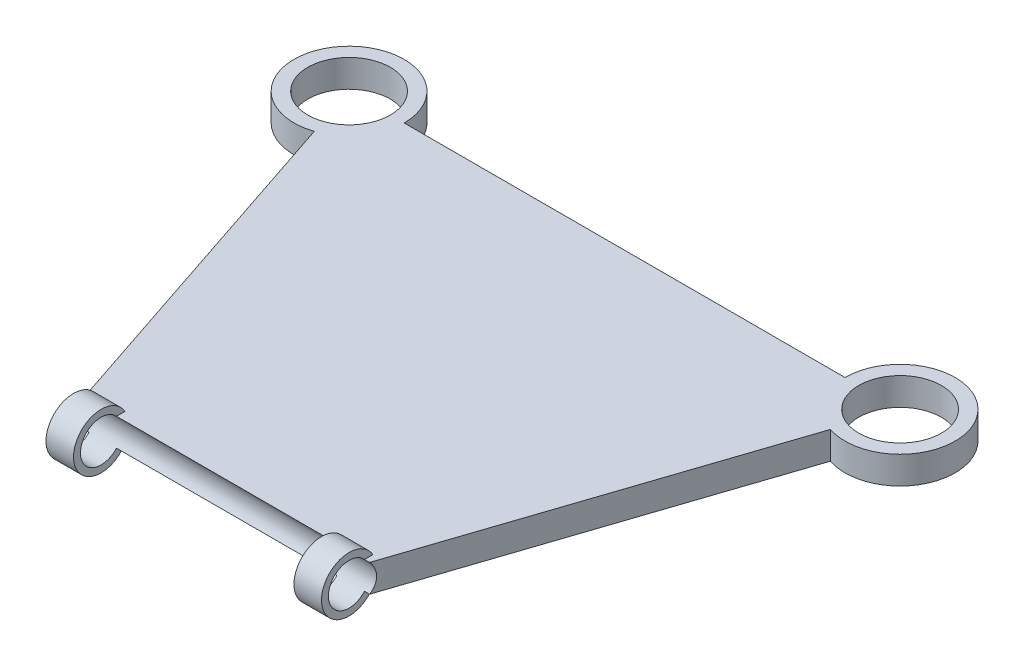
from build123d import *

# Parameters (mm, degrees)
SKETCH1_R               = 48
BOSS_EXTRUDE1_DEPTH     = 32
SKETCH2_R               = 32
SKETCH2_R_2             = 24
BOSS_EXTRUDE2_DEPTH     = 32
BOSS_EXTRUDE3_START     = 32
SKETCH3_R               = 32
SKETCH3_R_2             = 24
BOSS_EXTRUDE3_DEPTH     = 32
CUT_EXTRUDE1_DEPTH      = 32
CUT_EXTRUDE1_DEPTH_BACK = 689
SKETCH4_R               = 24


with BuildPart() as part:
    # Sketch1 → Boss-Extrude1 (new body)
    with BuildSketch(Plane(origin=(0, 0, 0), x_dir=(1, 0, 0), z_dir=(0, 1, 0))):
        with BuildLine():
            ThreePointArc((64, 0), (-51.919499851, 37.421458218), (20.238577025, -60.715731075))
            Line((20.238577025, -60.715731075), (160, -480))
            Line((160, -480), (480, -480))
            Line((480, -480), (619.761422975, -60.715731075))
            ThreePointArc((619.761422975, -60.715731075), (691.919499851, 37.421458218), (576, 0))
            Line((576, 0), (64, 0))
        make_face()
        with Locations(Location((0, 0, 0), (0, 0, 270))):
            Circle(SKETCH1_R, mode=Mode.SUBTRACT)
        with Locations(Location((640, 0, 0), (0, 0, 270))):
            Circle(SKETCH1_R, mode=Mode.SUBTRACT)
    extrude(amount=BOSS_EXTRUDE1_DEPTH)

    # Sketch2 → Boss-Extrude2 (add)
    with BuildSketch(Plane(origin=(160, 0, 0), x_dir=(0, -1, 0), z_dir=(-1, 0, 0))):
        with Locations((-16, 480)):
            Circle(SKETCH2_R)
        with Locations((-16, 480)):
            Circle(SKETCH2_R_2, mode=Mode.SUBTRACT)
    extrude(amount=-BOSS_EXTRUDE2_DEPTH)

    # Sketch3 → Boss-Extrude3 (add)
    with BuildSketch(Plane(origin=(480, 0, 0), x_dir=(0, -1, 0), z_dir=(-1, 0, 0)).offset(BOSS_EXTRUDE3_START)):
        with Locations((-16, 480)):
            Circle(SKETCH3_R)
        with Locations((-16, 480)):
            Circle(SKETCH3_R_2, mode=Mode.SUBTRACT)
    extrude(amount=-BOSS_EXTRUDE3_DEPTH)

    # Sketch4 → Cut-Extrude1 (cut, two sides: drawn at the far end of the back side and taken through both)
    with BuildSketch(Plane(origin=(160, 0, 0), x_dir=(0, -1, 0), z_dir=(-1, 0, 0)).offset(-CUT_EXTRUDE1_DEPTH_BACK)):
        with Locations(Location((-16, 480, 0), (0, 0, 228.189685104))):
            Circle(SKETCH4_R)
    extrude(amount=CUT_EXTRUDE1_DEPTH + CUT_EXTRUDE1_DEPTH_BACK, mode=Mode.SUBTRACT)


solid = part.part
